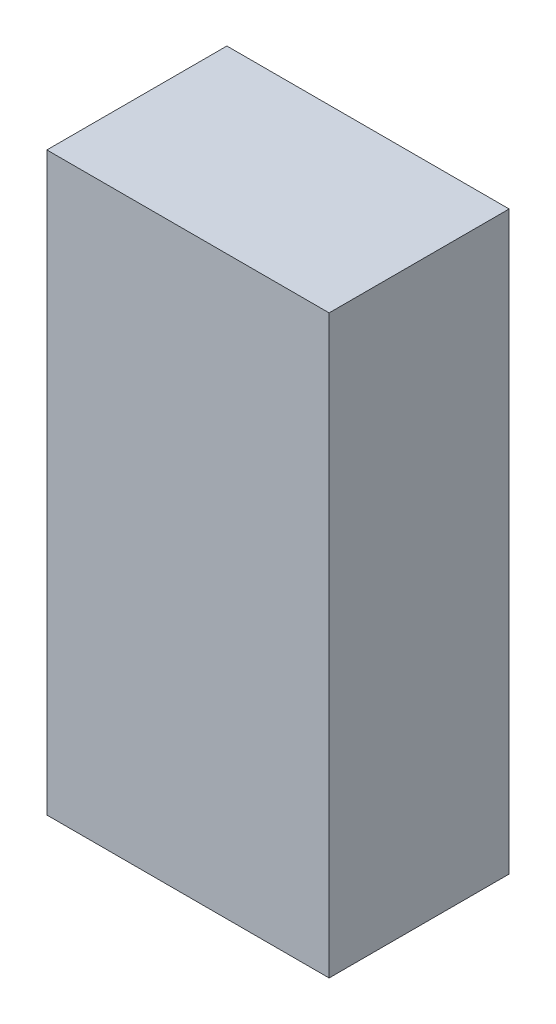
from build123d import *

# Parameters (mm, degrees)
SKETCH3_W           = 12.446
SKETCH3_H           = 25.4
BOSS_EXTRUDE1_DEPTH = 7.9375


with BuildPart() as part:
    # Sketch3 → Boss-Extrude1 (new body)
    with BuildSketch(Plane.XY):
        Rectangle(SKETCH3_W, SKETCH3_H)
    extrude(amount=BOSS_EXTRUDE1_DEPTH)


solid = part.part
